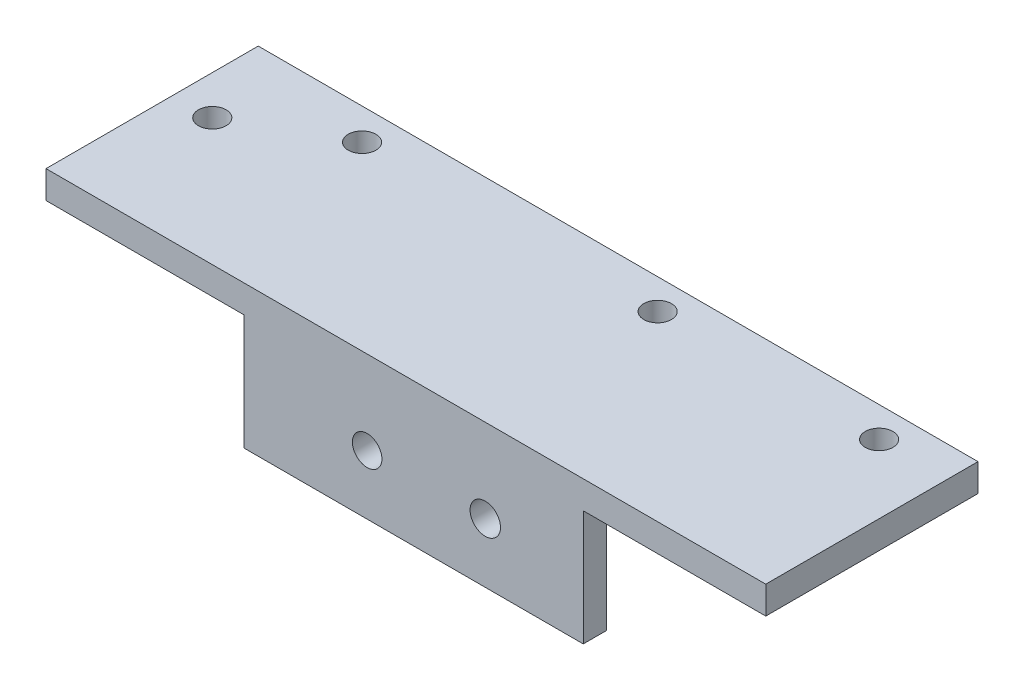
from build123d import *

# Parameters (mm, degrees)
SKETCH_1_W                = 78
SKETCH_1_H                = 15
EXTRUDE_1_DEPTH           = 3
SKETCH_3_R                = 1.5
CUT_EXTRUDE_1_DEPTH       = 3
SKETCH_4_R                = 6
EXTRUDE_2_DEPTH           = 18
SKETCH_5_R                = 4.5
CUT_EXTRUDE_2_DEPTH       = 21
F_2_0MM_2_D               = 3
F_2_0MM_2_DEPTH           = 4.5
F_2_0MM_2_TIP             = 1.5
F_2_0MM_2_ON_FACE_2_D     = 3
F_2_0MM_2_ON_FACE_2_DEPTH = 4.5
F_2_0MM_2_ON_FACE_2_TIP   = 1.5
SKETCH_10_W               = 6
SKETCH_10_H               = 10
CUT_EXTRUDE_3_DEPTH       = 7
SKETCH_13_W               = 19.835687411
SKETCH_13_H               = 21.610205193
CUT_EXTRUDE_4_DEPTH       = 20
SKETCH_14_W               = 11.523038103
SKETCH_14_H               = 10.49031299
EXTRUDE_3_DEPTH           = 3
SKETCH_18_W               = 78
SKETCH_18_H               = 8
EXTRUDE_4_DEPTH           = 3
SKETCH_19_W               = 36.767904102
SKETCH_19_H               = 2.5
EXTRUDE_5_DEPTH           = 12.5
SKETCH_23_R               = 1.65
CUT_EXTRUDE_6_DEPTH       = 12.5
SKETCH_25_W               = 4.236607592
SKETCH_25_H               = 5.36409187
EXTRUDE_7_DEPTH           = 2.5
SKETCH_26_R               = 1.6
CUT_EXTRUDE_7_DEPTH       = 2.5


with BuildPart() as part:
    # 草图1 → 凸台-拉伸1 (new body)
    with BuildSketch(Plane(origin=(0, 0, 0), x_dir=(1, 0, 0), z_dir=(0, 1, 0))):
        Rectangle(SKETCH_1_W, SKETCH_1_H)
    extrude(amount=EXTRUDE_1_DEPTH)

    # 草图3 → 切除-拉伸1 (cut)
    with BuildSketch(Plane(origin=(0, 3, 0), x_dir=(1, 0, 0), z_dir=(0, 1, 0))):
        with Locations(Location((-34.76, -1.72, 0), (0, 0, 270))):
            Circle(SKETCH_3_R)
        with Locations(Location((-24.35, 4.1, 0), (0, 0, 270))):
            Circle(SKETCH_3_R)
        with Locations(Location((31.56, 4.221692081, 0), (0, 0, 270))):
            Circle(SKETCH_3_R)
        with Locations(Location((7.56, 4.221692081, 0), (0, 0, 270))):
            Circle(SKETCH_3_R)
    extrude(amount=-CUT_EXTRUDE_1_DEPTH, mode=Mode.SUBTRACT)

    # 草图4 → 凸台-拉伸2 (add)
    with BuildSketch(Plane(origin=(0, 3, 0), x_dir=(1, 0, 0), z_dir=(0, 1, 0))):
        with Locations(Location((-3, -1.234165229, 0), (0, 0, 270))):
            Circle(SKETCH_4_R)
    extrude(amount=EXTRUDE_2_DEPTH)

    # 草图5 → 切除-拉伸2 (cut)
    with BuildSketch(Plane(origin=(0, 21, 0), x_dir=(1, 0, 0), z_dir=(0, 1, 0))):
        with Locations(Location((-3, -1.234165229, 0), (0, 0, 270))):
            Circle(SKETCH_5_R)
    extrude(amount=-CUT_EXTRUDE_2_DEPTH, mode=Mode.SUBTRACT)

    # Ø2.0mm 暗销孔2
    with Locations(Plane(origin=(-7.901331048, 17.342107422, 4.694938836), x_dir=(-0.576795601176, 0, -0.816888507977), z_dir=(-0.816888507977, 0, 0.576795601176))):
        with Locations((0, 0)):
            Hole(F_2_0MM_2_D / 2, depth=F_2_0MM_2_DEPTH)
            with Locations((0, 0, -(F_2_0MM_2_DEPTH + F_2_0MM_2_TIP / 2))):  # 90° drill point
                Cone(0, F_2_0MM_2_D / 2, F_2_0MM_2_TIP, mode=Mode.SUBTRACT)

    # Ø2.0mm 暗销孔2 on face 2
    with Locations(Plane(origin=(1.071764877, 17.164817099, 5.641061052), x_dir=(0.734483043181, 0, -0.678627039897), z_dir=(0.678627039897, 0, 0.734483043181))):
        with Locations((0, 0)):
            Hole(F_2_0MM_2_ON_FACE_2_D / 2, depth=F_2_0MM_2_ON_FACE_2_DEPTH)
            with Locations((0, 0, -(F_2_0MM_2_ON_FACE_2_DEPTH + F_2_0MM_2_ON_FACE_2_TIP / 2))):  # 90° drill point
                Cone(0, F_2_0MM_2_ON_FACE_2_D / 2, F_2_0MM_2_ON_FACE_2_TIP, mode=Mode.SUBTRACT)

    # 草图10 → 切除-拉伸3 (cut)
    with BuildSketch(Plane(origin=(0, 0, -7.5), x_dir=(-1, 0, 0), z_dir=(0, 0, -1))):
        with Locations((3, 8)):
            Rectangle(SKETCH_10_W, SKETCH_10_H)
    extrude(amount=-CUT_EXTRUDE_3_DEPTH, mode=Mode.SUBTRACT)

    # 草图13 → 切除-拉伸4 (cut)
    with BuildSketch(Plane(origin=(0, 0, -7.5), x_dir=(-1, 0, 0), z_dir=(0, 0, -1))):
        with Locations((3.314421038, 13.805102597)):
            Rectangle(SKETCH_13_W, SKETCH_13_H)
    extrude(amount=-CUT_EXTRUDE_4_DEPTH, mode=Mode.SUBTRACT)

    # 草图14 → 凸台-拉伸3 (add)
    with BuildSketch(Plane(origin=(0, 3, 0), x_dir=(1, 0, 0), z_dir=(0, 1, 0))):
        with Locations((-2.989467433, -1.263493391)):
            Rectangle(SKETCH_14_W, SKETCH_14_H)
    extrude(amount=-EXTRUDE_3_DEPTH)

    # 草图18 → 凸台-拉伸4 (add)
    with BuildSketch(Plane.XZ):
        with Locations((0, 11.5)):
            Rectangle(SKETCH_18_W, SKETCH_18_H)
    extrude(amount=-EXTRUDE_4_DEPTH)

    # 草图19 → 凸台-拉伸5 (add)
    with BuildSketch(Plane.XZ):
        with Locations((0.839237194, 14.25)):
            Rectangle(SKETCH_19_W, SKETCH_19_H)
    extrude(amount=EXTRUDE_5_DEPTH)

    # 草图23 → 切除-拉伸6 (cut)
    with BuildSketch(Plane(origin=(0, 0, 13), x_dir=(-1, 0, 0), z_dir=(0, 0, -1))):
        with Locations((-8.603189245, -6.05592298)):
            Circle(SKETCH_23_R)
        with Locations((2.596810755, -6.05592298)):
            Circle(SKETCH_23_R)
    extrude(amount=-CUT_EXTRUDE_6_DEPTH, mode=Mode.SUBTRACT)

    # 草图25 → 凸台-拉伸7 (add)
    with BuildSketch(Plane(origin=(0, 0, 13), x_dir=(-1, 0, 0), z_dir=(0, 0, -1))):
        with Locations((2.330668631, -6.426480946)):
            Rectangle(SKETCH_25_W, SKETCH_25_H)
    extrude(amount=-EXTRUDE_7_DEPTH)

    # 草图26 → 切除-拉伸7 (cut)
    with BuildSketch(Plane(origin=(0, 0, 13), x_dir=(-1, 0, 0), z_dir=(0, 0, -1))):
        with Locations((4.196810755, -6.05592298)):
            Circle(SKETCH_26_R)
    extrude(amount=-CUT_EXTRUDE_7_DEPTH, mode=Mode.SUBTRACT)


solid = part.part
